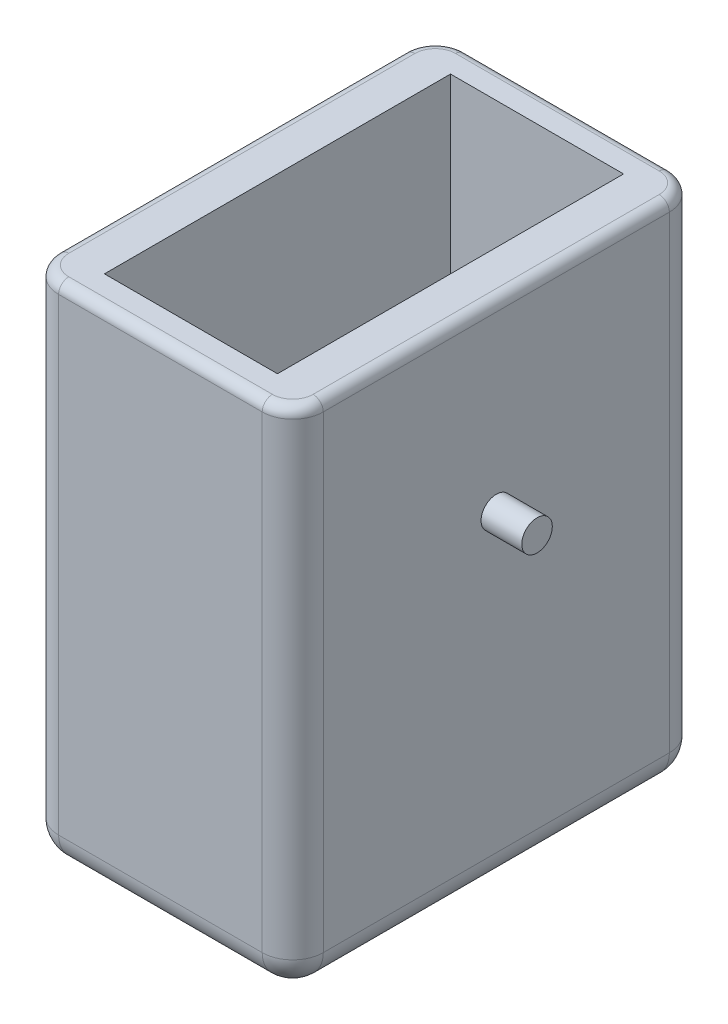
from build123d import *

# Parameters (mm, degrees)
CROQUIS1_W              = 26
CROQUIS1_H              = 40
SALIENTE_EXTRUIR1_DEPTH = 50
CROQUIS2_W              = 17
CROQUIS2_H              = 34
CORTAR_EXTRUIR1_DEPTH   = 47
REDONDEO1_R             = 3
REDONDEO2_R             = 1
CROQUIS4_R              = 1.5
SALIENTE_EXTRUIR2_DEPTH = 4
SALIENTE_EXTRUIR3_START = 4
CROQUIS5_R              = 1.5
SALIENTE_EXTRUIR3_DEPTH = 4


with BuildPart() as part:
    # Croquis1 → Saliente-Extruir1 (new body)
    with BuildSketch(Plane(origin=(0, 0, 0), x_dir=(1, 0, 0), z_dir=(0, 1, 0))):
        with Locations((-13, 20)):
            Rectangle(CROQUIS1_W, CROQUIS1_H)
    extrude(amount=SALIENTE_EXTRUIR1_DEPTH)

    # Croquis2 → Cortar-Extruir1 (cut)
    with BuildSketch(Plane(origin=(0, 50, 0), x_dir=(1, 0, 0), z_dir=(0, 1, 0))):
        with Locations((-13, 20)):
            Rectangle(CROQUIS2_W, CROQUIS2_H)
    extrude(amount=-CORTAR_EXTRUIR1_DEPTH, mode=Mode.SUBTRACT)

    # Redondeo1
    redondeo1_edges = [part.edges().sort_by_distance(p)[0] for p in [
        (-13, 0, 0),
        (-26, 0, -20),
        (-13, 0, -40),
        (0, 0, -20),
        (0, 25, 0),
        (-26, 25, 0),
        (-26, 25, -40),
        (0, 25, -40),
    ]]
    fillet(redondeo1_edges, radius=REDONDEO1_R)

    # Redondeo2
    redondeo2_edges = [part.edges().sort_by_distance(p)[0] for p in [
        (-13, 50, -40),
        (-26, 50, -20),
        (-13, 50, 0),
        (0, 50, -20),
        (-25.121320344, 50, -0.878679656),
        (-0.878679656, 50, -0.878679656),
        (-0.878679656, 50, -39.121320344),
        (-25.121320344, 50, -39.121320344),
    ]]
    fillet(redondeo2_edges, radius=REDONDEO2_R)

    # Croquis4 → Saliente-Extruir2 (add)
    with BuildSketch(Plane.ZY.offset(26)):
        with Locations(Location((-20, 32, 0), (0, 0, 180))):
            Circle(CROQUIS4_R)
    extrude(amount=SALIENTE_EXTRUIR2_DEPTH)

    # Croquis5 → Saliente-Extruir3 (add)
    with BuildSketch(Plane(origin=(0, 0, 0), x_dir=(0, 0, -1), z_dir=(1, 0, 0)).offset(SALIENTE_EXTRUIR3_START)):
        with Locations((20, 32)):
            Circle(CROQUIS5_R)
    extrude(amount=-SALIENTE_EXTRUIR3_DEPTH)


solid = part.part
